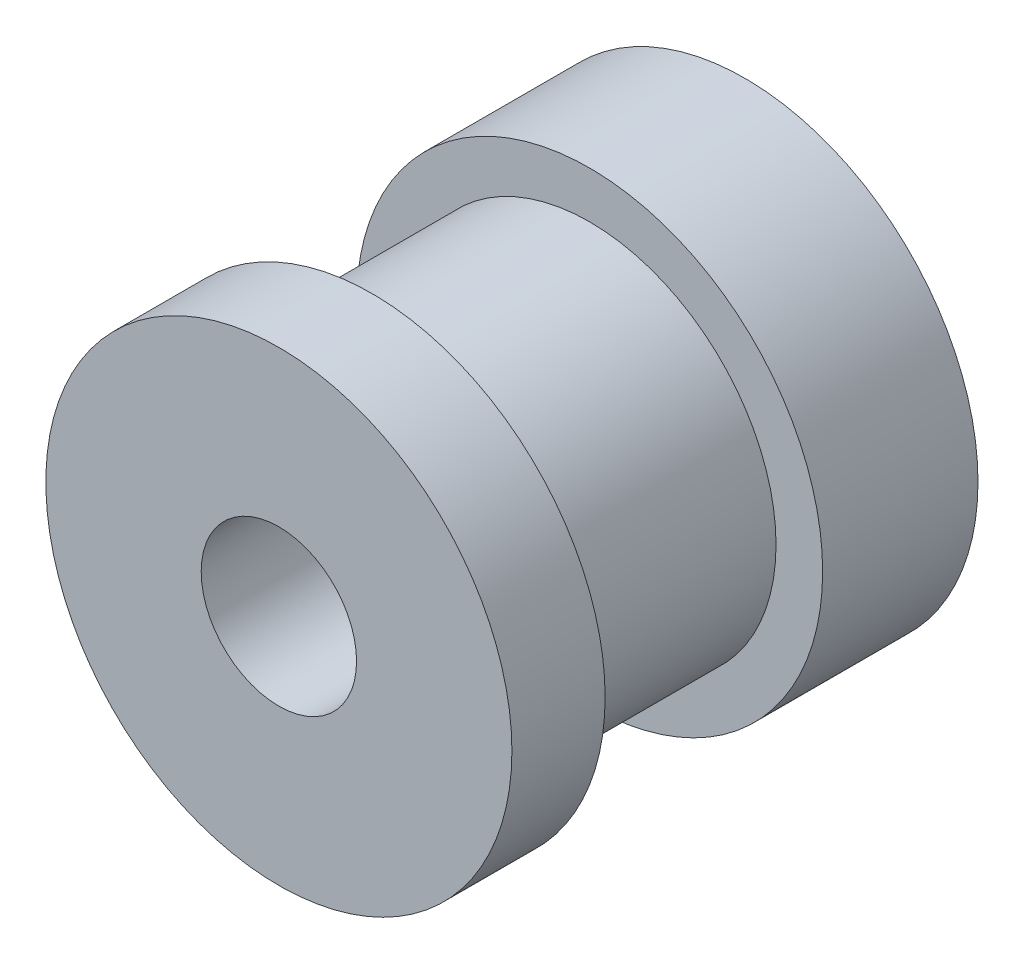
from build123d import *

# Parameters (mm, degrees)
ESQUISSE1_R             = 7.5
BOSS_EXTRU_1_DEPTH      = 5
ESQUISSE2_R             = 6
BOSS_EXTRU_2_DEPTH      = 7
ESQUISSE3_R             = 7.5
BOSS_EXTRU_3_DEPTH      = 3
ESQUISSE4_R             = 2.5
ENL_V_MAT_EXTRU_1_DEPTH = 30


with BuildPart() as part:
    # Esquisse1 → Boss.-Extru.1 (new body)
    with BuildSketch(Plane.XY):
        Circle(ESQUISSE1_R)
    extrude(amount=BOSS_EXTRU_1_DEPTH)

    # Esquisse2 → Boss.-Extru.2 (add)
    with BuildSketch(Plane.XY.offset(5)):
        Circle(ESQUISSE2_R)
    extrude(amount=BOSS_EXTRU_2_DEPTH)

    # Esquisse3 → Boss.-Extru.3 (add)
    with BuildSketch(Plane.XY.offset(12)):
        Circle(ESQUISSE3_R)
    extrude(amount=BOSS_EXTRU_3_DEPTH)

    # Esquisse4 → Enlèv. mat.-Extru.1 (cut)
    with BuildSketch(Plane(origin=(0, 0, 0), x_dir=(-1, 0, 0), z_dir=(0, 0, -1))):
        Circle(ESQUISSE4_R)
    extrude(amount=-ENL_V_MAT_EXTRU_1_DEPTH, mode=Mode.SUBTRACT)


solid = part.part
